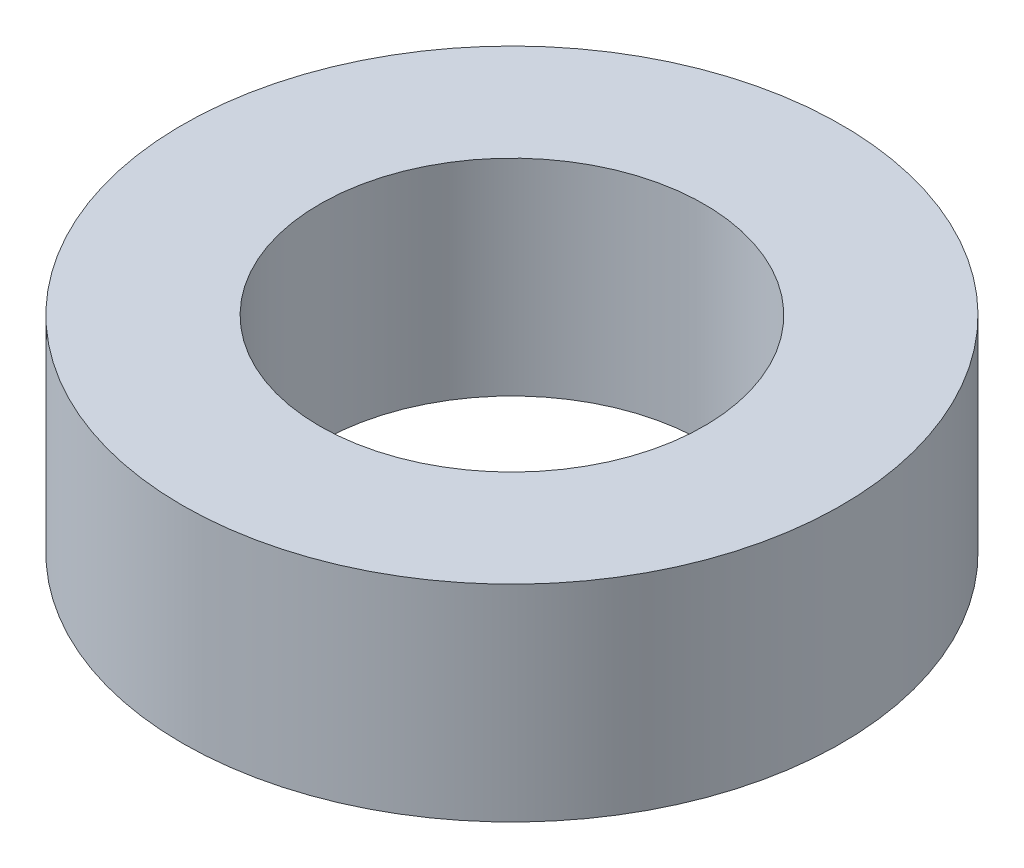
from build123d import *

# Parameters (mm, degrees)
SKETCH1_R           = 6
SKETCH1_R_2         = 3.5
BOSS_EXTRUDE1_DEPTH = 3.75


with BuildPart() as part:
    # Sketch1 → Boss-Extrude1 (new body)
    with BuildSketch(Plane(origin=(0, 0, 0), x_dir=(1, 0, 0), z_dir=(0, 1, 0))):
        with Locations(Location((0, 0, 0), (0, 0, 270))):
            Circle(SKETCH1_R)
        with Locations(Location((0, 0, 0), (0, 0, 270))):
            Circle(SKETCH1_R_2, mode=Mode.SUBTRACT)
    extrude(amount=BOSS_EXTRUDE1_DEPTH)


solid = part.part
